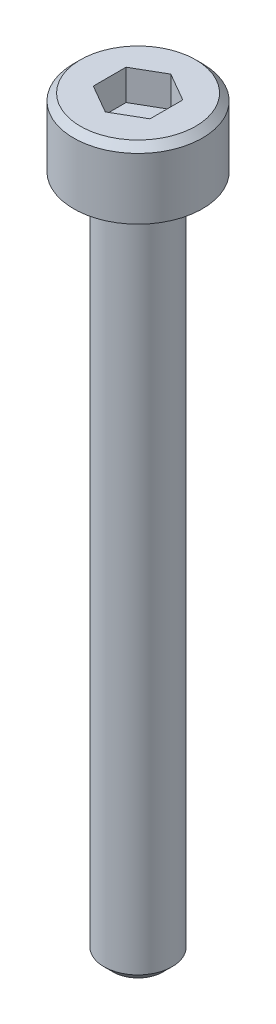
from build123d import *

# Parameters (mm, degrees)
CUT_EXTRUDE1_DEPTH = 1.35


with BuildPart() as part:
    # Sketch1 → Revolve1 (revolve)
    with BuildSketch(Plane.XY, mode=Mode.PRIVATE) as revolve1_sk:
        Polygon((0, -30), (1.1, -30), (1.5, -29.6), (1.5, 0), (2.84, 0), (2.84, 2.7), (2.54, 3), (0, 3), align=None)
    revolve(revolve1_sk.sketch.rotate(Axis((0, -10, 0), (0, 1, 0)), 90), axis=Axis((0, -10, 0), (0, 1, 0)))

    # Sketch2 → Cut-Extrude1 (cut)
    with BuildSketch(Plane(origin=(0, 3, 0), x_dir=(1, 0, 0), z_dir=(0, 1, 0))):
        Polygon((1.25, -0.721687836), (0, -1.443375673), (-1.25, -0.721687836), (-1.25, 0.721687836), (0, 1.443375673), (1.25, 0.721687836), align=None)
    extrude(amount=-CUT_EXTRUDE1_DEPTH, mode=Mode.SUBTRACT)


solid = part.part
